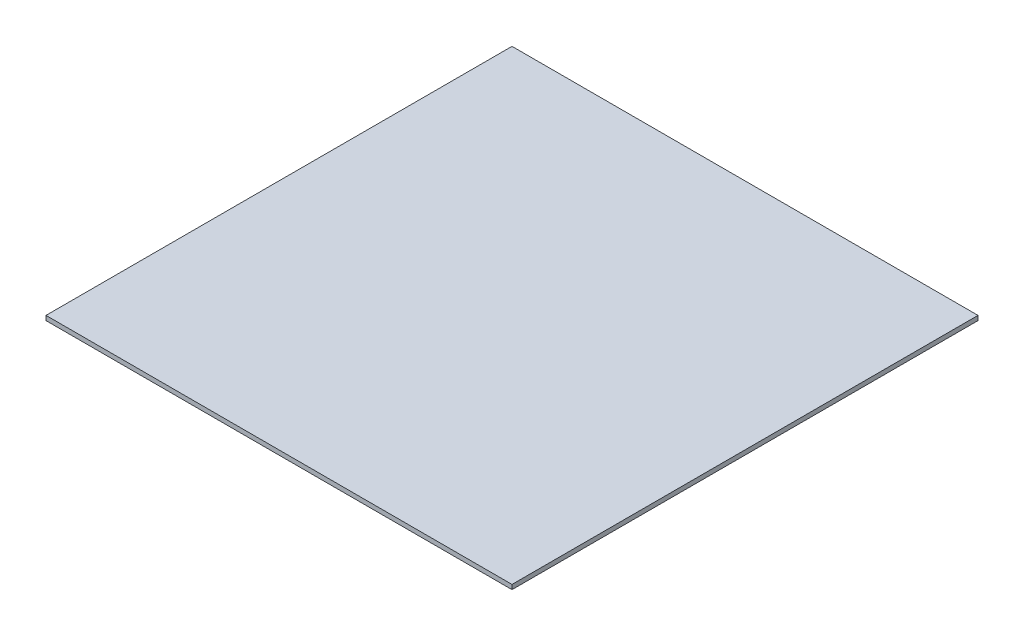
from build123d import *

# Parameters (mm, degrees)
SKETCH1_W           = 410
SKETCH1_H           = 410
BOSS_EXTRUDE1_DEPTH = 4


with BuildPart() as part:
    # Sketch1 → Boss-Extrude1 (new body)
    with BuildSketch(Plane(origin=(0, 0, 0), x_dir=(1, 0, 0), z_dir=(0, 1, 0))):
        Rectangle(SKETCH1_W, SKETCH1_H)
    extrude(amount=BOSS_EXTRUDE1_DEPTH)


solid = part.part
